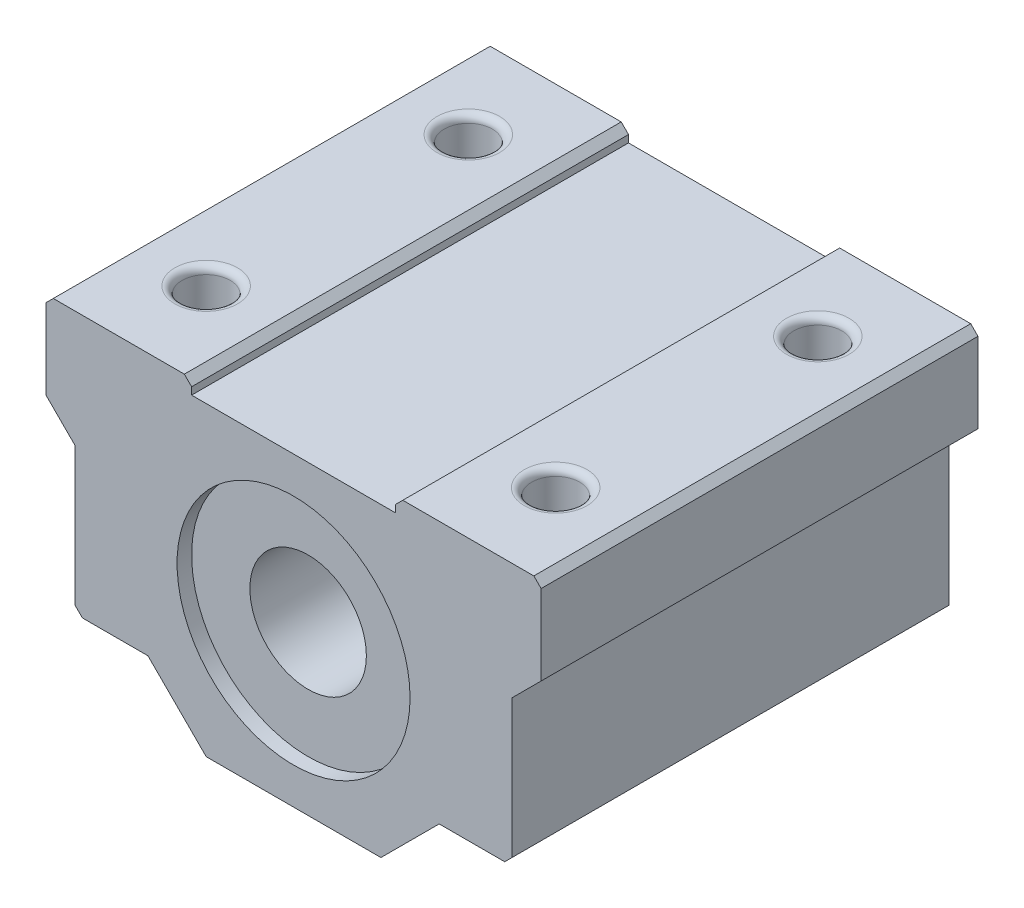
from build123d import *

# Parameters (mm, degrees)
SKETCH1_R           = 8
BOSS_EXTRUDE1_DEPTH = 15
SKETCH2_R           = 1.65
CUT_EXTRUDE1_DEPTH  = 32.591137998
SKETCH3_R           = 8
SKETCH3_R_2         = 4
BOSS_EXTRUDE2_DEPTH = 14
FILLET1_R           = 0.5
CHAMFER1_SIZE       = 0.5


with BuildPart() as part:
    # Sketch1 → Boss-Extrude1 (new, symmetric)
    with BuildSketch(Plane.XY):
        Polygon((-17, 11.5), (-7, 11.5), (-7, 10.5), (7, 10.5), (7, 11.5), (17, 11.5), (17, 5.5), (15, 3.5), (15, -6.5), (10, -6.5), (6, -10.5), (-6, -10.5), (-10, -6.5), (-15, -6.5), (-15, 3.5), (-17, 5.5), align=None)
        Circle(SKETCH1_R, mode=Mode.SUBTRACT)
    extrude(amount=BOSS_EXTRUDE1_DEPTH, both=True)

    # Sketch2 → Cut-Extrude1 (cut, through all)
    with BuildSketch(Plane(origin=(0, 11.5, 0), x_dir=(1, 0, 0), z_dir=(0, 1, 0))):
        with Locations(Location((-12, 9, 0), (0, 0, 270))):
            Circle(SKETCH2_R)
        with Locations(Location((-12, -9, 0), (0, 0, 270))):
            Circle(SKETCH2_R)
        with Locations(Location((12, -9, 0), (0, 0, 270))):
            Circle(SKETCH2_R)
        with Locations(Location((12, 9, 0), (0, 0, 270))):
            Circle(SKETCH2_R)
    extrude(amount=-CUT_EXTRUDE1_DEPTH, mode=Mode.SUBTRACT)

    # Sketch3 → Boss-Extrude2 (add, symmetric)
    with BuildSketch(Plane.XY):
        Circle(SKETCH3_R)
        Circle(SKETCH3_R_2, mode=Mode.SUBTRACT)
    extrude(amount=BOSS_EXTRUDE2_DEPTH, both=True)

    # Fillet1
    fillet1_edges = [part.edges().sort_by_distance(p)[0] for p in [
        (-12, 11.5, -10.65),
        (-12, 11.5, 7.35),
        (12, 11.5, 7.35),
        (12, 11.5, -10.65),
    ]]
    fillet(fillet1_edges, radius=FILLET1_R)

    # Chamfer1
    chamfer1_edges = [part.edges().sort_by_distance(p)[0] for p in [
        (-17, 11.5, 0),
        (-7, 11.5, 0),
        (7, 11.5, 0),
        (17, 11.5, 0),
        (15, -6.5, 0),
        (-15, -6.5, 0),
    ]]
    chamfer(chamfer1_edges, length=CHAMFER1_SIZE)


solid = part.part
